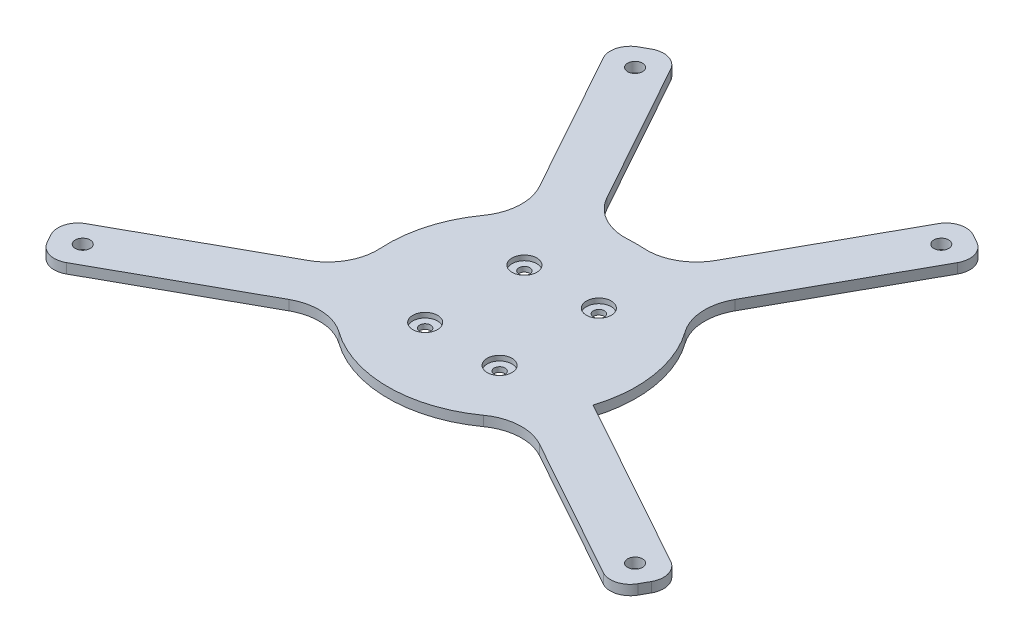
from build123d import *

# Parameters (mm, degrees)
SKETCH1_R           = 25
SKETCH1_R_2         = 1.1
BOSS_EXTRUDE1_DEPTH = 2
SKETCH2_R           = 2.5
CUT_EXTRUDE1_DEPTH  = 1
SKETCH3_R           = 1.5
BOSS_EXTRUDE2_DEPTH = 2
FILLET1_R           = 10
FILLET2_R           = 10


with BuildPart() as part:
    # Sketch1 → Boss-Extrude1 (new body)
    with BuildSketch(Plane(origin=(0, 0, 0), x_dir=(1, 0, 0), z_dir=(0, 1, 0))):
        with Locations(Location((0, 0, 0), (0, 0, 270))):
            Circle(SKETCH1_R)
        with Locations(Location((-7.5, 10, 0), (0, 0, 270))):
            Circle(SKETCH1_R_2, mode=Mode.SUBTRACT)
        with Locations(Location((7.5, 10, 0), (0, 0, 270))):
            Circle(SKETCH1_R_2, mode=Mode.SUBTRACT)
        with Locations(Location((-7.5, -10, 0), (0, 0, 270))):
            Circle(SKETCH1_R_2, mode=Mode.SUBTRACT)
        with Locations(Location((7.5, -10, 0), (0, 0, 270))):
            Circle(SKETCH1_R_2, mode=Mode.SUBTRACT)
    extrude(amount=BOSS_EXTRUDE1_DEPTH)

    # Sketch2 → Cut-Extrude1 (cut)
    with BuildSketch(Plane(origin=(0, 2, 0), x_dir=(1, 0, 0), z_dir=(0, 1, 0))):
        with Locations(Location((-7.5, 10, 0), (0, 0, 270))):
            Circle(SKETCH2_R)
        with Locations(Location((7.5, 10, 0), (0, 0, 270))):
            Circle(SKETCH2_R)
        with Locations(Location((-7.5, -10, 0), (0, 0, 270))):
            Circle(SKETCH2_R)
        with Locations(Location((7.5, -10, 0), (0, 0, 270))):
            Circle(SKETCH2_R)
    extrude(amount=-CUT_EXTRUDE1_DEPTH, mode=Mode.SUBTRACT)

    # Sketch3 → Boss-Extrude2 (add)
    # profile 1 of 4: a face of its own
    with BuildSketch(Plane(origin=(0, 0, 0), x_dir=(1, 0, 0), z_dir=(0, 1, 0))):
        with BuildLine():
            Line((-7.503148867, 23.847489534), (-26.96183357, 58.948812182))
            ThreePointArc((-26.96183357, 58.948812182), (-29.357833738, 60.85453152), (-32.399608771, 60.507850621))
            Line((-32.399608771, 60.507850621), (-34.148812182, 59.53816643))
            ThreePointArc((-34.148812182, 59.53816643), (-36.05453152, 57.142166262), (-35.707850621, 54.100391229))
            Line((-35.707850621, 54.100391229), (-16.249165919, 18.999068581))
            ThreePointArc((-16.249165919, 18.999068581), (-12.121052382, 21.865042628), (-7.503148867, 23.847489534))
        make_face()
        with Locations(Location((-30.85, 55.65, 0), (0, 0, 270))):
            Circle(SKETCH3_R, mode=Mode.SUBTRACT)
    # profile 2 of 4: a face of its own
    with BuildSketch(Plane(origin=(0, 0, 0), x_dir=(1, 0, 0), z_dir=(0, 1, 0))):
        with BuildLine():
            Line((-58.948812182, -26.96183357), (-23.847489534, -7.503148867))
            ThreePointArc((-23.847489534, -7.503148867), (-21.865042628, -12.121052382), (-18.999068581, -16.249165919))
            Line((-18.999068581, -16.249165919), (-54.100391229, -35.707850621))
            ThreePointArc((-54.100391229, -35.707850621), (-57.142166262, -36.05453152), (-59.53816643, -34.148812182))
            Line((-59.53816643, -34.148812182), (-60.507850621, -32.399608771))
            ThreePointArc((-60.507850621, -32.399608771), (-60.85453152, -29.357833738), (-58.948812182, -26.96183357))
        make_face()
        with Locations(Location((-55.65, -30.85, 0), (0, 0, 270))):
            Circle(SKETCH3_R, mode=Mode.SUBTRACT)
    # profile 3 of 4: a face of its own
    with BuildSketch(Plane(origin=(0, 0, 0), x_dir=(1, 0, 0), z_dir=(0, 1, 0))):
        with BuildLine():
            Line((60.507850621, -32.399608771), (59.53816643, -34.148812182))
            ThreePointArc((59.53816643, -34.148812182), (57.142166262, -36.05453152), (54.100391229, -35.707850621))
            Line((54.100391229, -35.707850621), (18.999068581, -16.249165919))
            ThreePointArc((18.999068581, -16.249165919), (21.865042628, -12.121052382), (23.847489534, -7.503148867))
            Line((23.847489534, -7.503148867), (58.948812182, -26.96183357))
            ThreePointArc((58.948812182, -26.96183357), (60.85453152, -29.357833738), (60.507850621, -32.399608771))
        make_face()
        with Locations(Location((55.65, -30.85, 0), (0, 0, 90))):
            Circle(SKETCH3_R, mode=Mode.SUBTRACT)
    # profile 4 of 4: a face of its own
    with BuildSketch(Plane(origin=(0, 0, 0), x_dir=(1, 0, 0), z_dir=(0, 1, 0))):
        with BuildLine():
            Line((32.399608771, 60.507850621), (34.148812182, 59.53816643))
            ThreePointArc((34.148812182, 59.53816643), (36.05453152, 57.142166262), (35.707850621, 54.100391229))
            Line((35.707850621, 54.100391229), (16.249165919, 18.999068581))
            ThreePointArc((16.249165919, 18.999068581), (12.121052382, 21.865042628), (7.503148867, 23.847489534))
            Line((7.503148867, 23.847489534), (26.96183357, 58.948812182))
            ThreePointArc((26.96183357, 58.948812182), (29.357833738, 60.85453152), (32.399608771, 60.507850621))
        make_face()
        with Locations(Location((30.85, 55.65, 0), (0, 0, 90))):
            Circle(SKETCH3_R, mode=Mode.SUBTRACT)
    extrude(amount=BOSS_EXTRUDE2_DEPTH)

    # Fillet1
    fillet1_edges = [part.edges().sort_by_distance(p)[0] for p in [
        (-7.503148867, 1, -23.847489534),
        (-16.249165919, 1, -18.999068581),
        (-23.847489534, 1, 7.503148867),
        (-18.999068581, 1, 16.249165919),
        (18.999068581, 1, 16.249165919),
        (16.249165919, 1, -18.999068581),
    ]]
    fillet(fillet1_edges, radius=FILLET1_R)

    # Fillet2
    fillet2_edges = [part.edges().sort_by_distance(p)[0] for p in [
        (7.503148867, 1, -23.847489534),
    ]]
    fillet(fillet2_edges, radius=FILLET2_R)


solid = part.part
